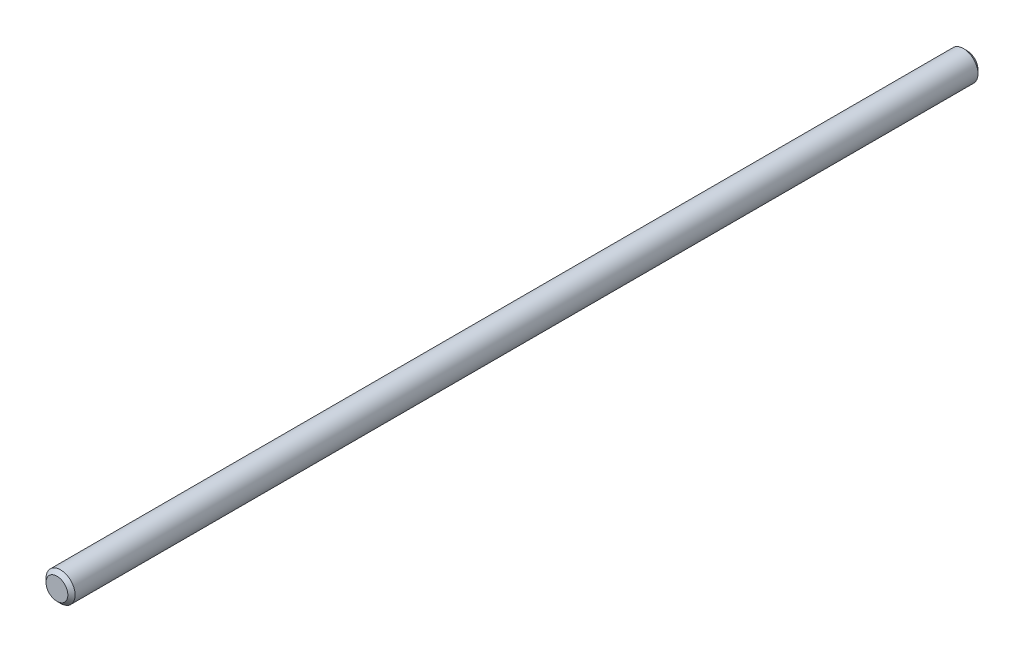
from build123d import *

# Parameters (mm, degrees)
SKETCH1_R           = 4
BOSS_EXTRUDE1_DEPTH = 125
CHAMFER2_SIZE       = 1
CHAMFER3_SIZE       = 1


with BuildPart() as part:
    # Sketch1 → Boss-Extrude1 (new body)
    with BuildSketch(Plane.XY):
        Circle(SKETCH1_R)
    extrude(amount=BOSS_EXTRUDE1_DEPTH)

    # Mirror2: part across plane


with BuildPart() as part_1:
    add(part.part)
    add(part.part.mirror(Plane.XY))

    # Chamfer2
    chamfer2_edges = [part_1.edges().sort_by_distance(p)[0] for p in [
        (-4, 0, -125),
    ]]
    chamfer(chamfer2_edges, length=CHAMFER2_SIZE)

    # Chamfer3
    chamfer3_edges = [part_1.edges().sort_by_distance(p)[0] for p in [
        (-4, 0, 125),
    ]]
    chamfer(chamfer3_edges, length=CHAMFER3_SIZE)


solid = part_1.part
